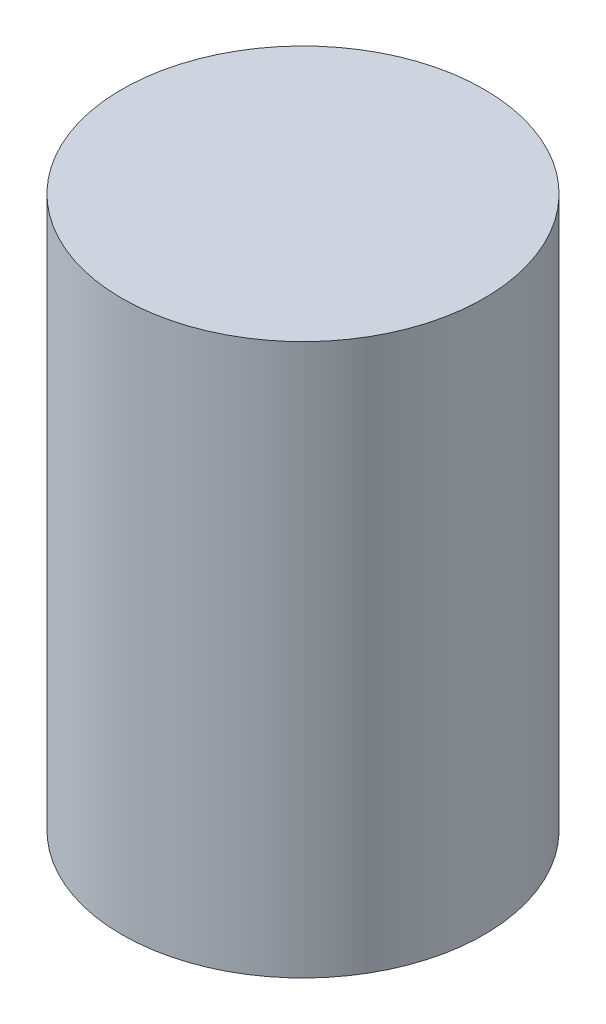
from build123d import *

# Parameters (mm, degrees)
SKETCH1_R           = 292.1
BOSS_EXTRUDE1_DEPTH = 889


with BuildPart() as part:
    # Sketch1 → Boss-Extrude1 (new body)
    with BuildSketch(Plane(origin=(0, 0, 0), x_dir=(1, 0, 0), z_dir=(0, 1, 0))):
        with Locations(Location((0, 0, 0), (0, 0, 270))):
            Circle(SKETCH1_R)
    extrude(amount=BOSS_EXTRUDE1_DEPTH)


solid = part.part
